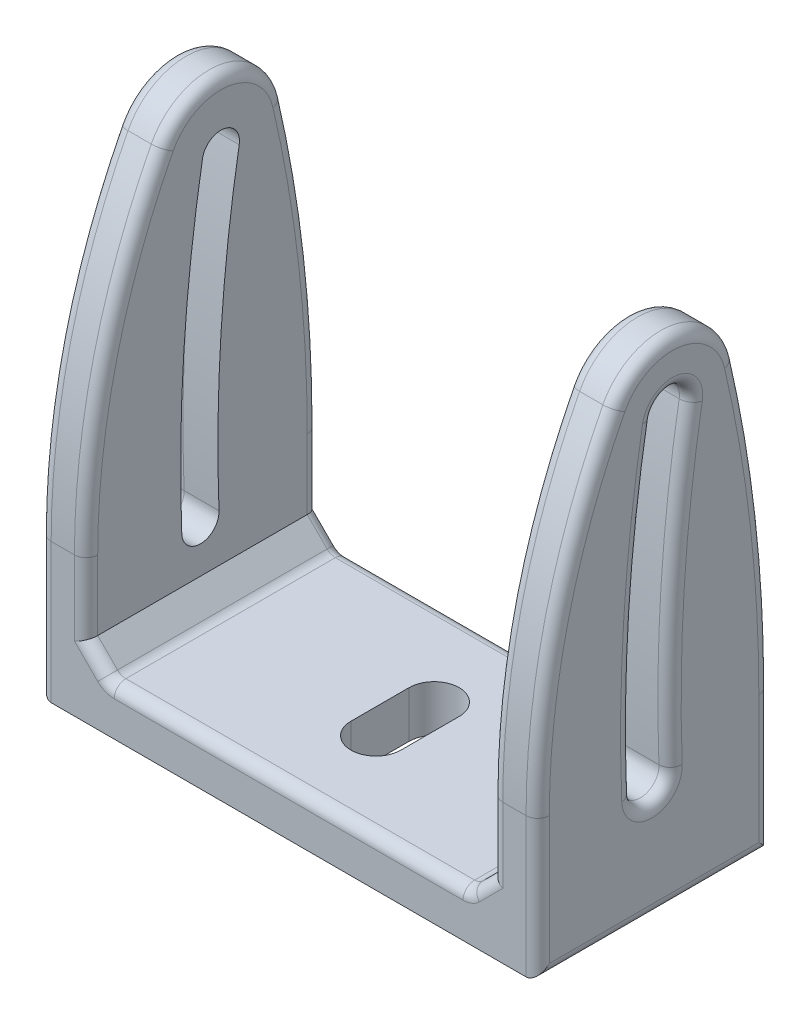
from build123d import *

# Parameters (mm, degrees)
BOSS_EXTRUDE1_DEPTH = 42.8
SKETCH2_W           = 34.8
SKETCH2_H           = 38.311897311
CUT_EXTRUDE1_DEPTH  = 60.585181768
CHAMFER1_SIZE       = 2
FILLET1_R           = 1
CUT_EXTRUDE2_DEPTH  = 59.306444702


with BuildPart() as part:
    # Sketch1 → Boss-Extrude1 (new body)
    with BuildSketch(Plane(origin=(0, 0, 0), x_dir=(0, 0, -1), z_dir=(1, 0, 0))):
        with BuildLine():
            Line((-10, -6), (10, -6))
            Line((10, -6), (10, 6))
            ThreePointArc((10, 6), (9.25619767, 19.071476996), (7.034393072, 31.974202951))
            ThreePointArc((7.034393072, 31.974202951), (2.269388413, 36.269117533), (-3.402199146, 33.271676085))
            ThreePointArc((-3.402199146, 33.271676085), (-8.327095908, 20.029213205), (-10, 6))
            Line((-10, 6), (-10, -6))
        make_face()
        with BuildLine():
            ThreePointArc((0.001705571, 30.983312005), (-1.596543983, 17.513106187), (-1.778018244, 3.949628997))
            ThreePointArc((-1.778018244, 3.949628997), (-0.116879823, 2.413198345), (1.419550828, 4.074336766))
            ThreePointArc((1.419550828, 4.074336766), (1.596543983, 17.302893813), (3.15532829, 30.440482617))
            ThreePointArc((3.15532829, 30.440482617), (1.849931624, 32.288708671), (0.001705571, 30.983312005))
        make_face(mode=Mode.SUBTRACT)
    extrude(amount=BOSS_EXTRUDE1_DEPTH)

    # Sketch2 → Cut-Extrude1 (cut, through all)
    with BuildSketch(Plane.XY.offset(10)):
        with Locations((21.4, 17.155948656)):
            Rectangle(SKETCH2_W, SKETCH2_H)
    extrude(amount=-CUT_EXTRUDE1_DEPTH, mode=Mode.SUBTRACT)

    # Chamfer1
    chamfer1_edges = [part.edges().sort_by_distance(p)[0] for p in [
        (4, -2, 0),
        (38.8, -2, 0),
    ]]
    chamfer(chamfer1_edges, length=CHAMFER1_SIZE)

    # Fillet1
    fillet1_edges = [part.edges().sort_by_distance(p)[0] for p in [
        (42.8, 20.029213205, 8.327095908),
        (42.8, 0, 10),
        (42.8, -6, 0),
        (42.8, 0, -10),
        (0, 32.288708671, -1.849931624),
        (0, 17.513106187, 1.596543983),
        (0, 2.413198345, 0.116879823),
        (0, 17.302893813, -1.596543983),
        (42.8, 32.288708671, -1.849931624),
        (42.8, 17.513106187, 1.596543983),
        (42.8, 2.413198345, 0.116879823),
        (42.8, 17.302893813, -1.596543983),
        (42.8, 19.071476996, -9.25619767),
        (4, 36.269117533, -2.269388413),
        (4, 19.071476996, -9.25619767),
        (4, 3, -10),
        (4, 20.029213205, 8.327095908),
        (38.8, 19.071476996, -9.25619767),
        (38.8, 36.269117533, -2.269388413),
        (38.8, 20.029213205, 8.327095908),
        (4, 3, 10),
        (0, 0, -10),
        (0, -6, 0),
        (0, 0, 10),
        (42.8, 36.269117533, -2.269388413),
        (38.8, 3, -10),
        (38.8, 3, 10),
        (21.4, -2, 10),
        (0, 20.029213205, 8.327095908),
        (21.4, -2, -10),
        (6, -2, 0),
        (36.8, -2, 0),
        (37.8, -1, 10),
        (37.8, -1, -10),
        (5, -1, 10),
        (0, 36.269117533, -2.269388413),
        (5, -1, -10),
        (0, 19.071476996, -9.25619767),
    ]]
    fillet(fillet1_edges, radius=FILLET1_R)

    # Sketch3 → Cut-Extrude2 (cut, through all)
    with BuildSketch(Plane(origin=(0, -2, 0), x_dir=(1, 0, 0), z_dir=(0, 1, 0))):
        with BuildLine():
            Line((19.25, -2.5), (19.25, 2.5))
            ThreePointArc((19.25, 2.5), (21.4, 4.65), (23.55, 2.5))
            Line((23.55, 2.5), (23.55, -2.5))
            ThreePointArc((23.55, -2.5), (21.4, -4.65), (19.25, -2.5))
        make_face()
    extrude(amount=-CUT_EXTRUDE2_DEPTH, mode=Mode.SUBTRACT)


solid = part.part
